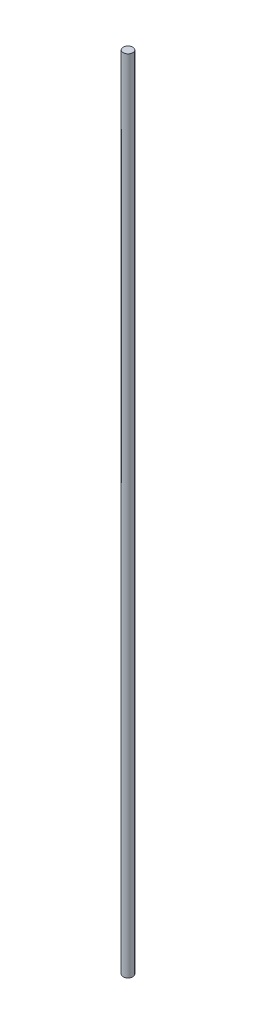
from build123d import *

# Parameters (mm, degrees)
SKETCH2_R           = 12.5
BOSS_EXTRUDE1_DEPTH = 2080


with BuildPart() as part:
    # Sketch2 → Boss-Extrude1 (new body)
    with BuildSketch(Plane(origin=(0, 0, 0), x_dir=(1, 0, 0), z_dir=(0, 1, 0))):
        with Locations(Location((0, 2.986809402, 0), (0, 0, 270))):
            Circle(SKETCH2_R)
    extrude(amount=BOSS_EXTRUDE1_DEPTH)


solid = part.part
